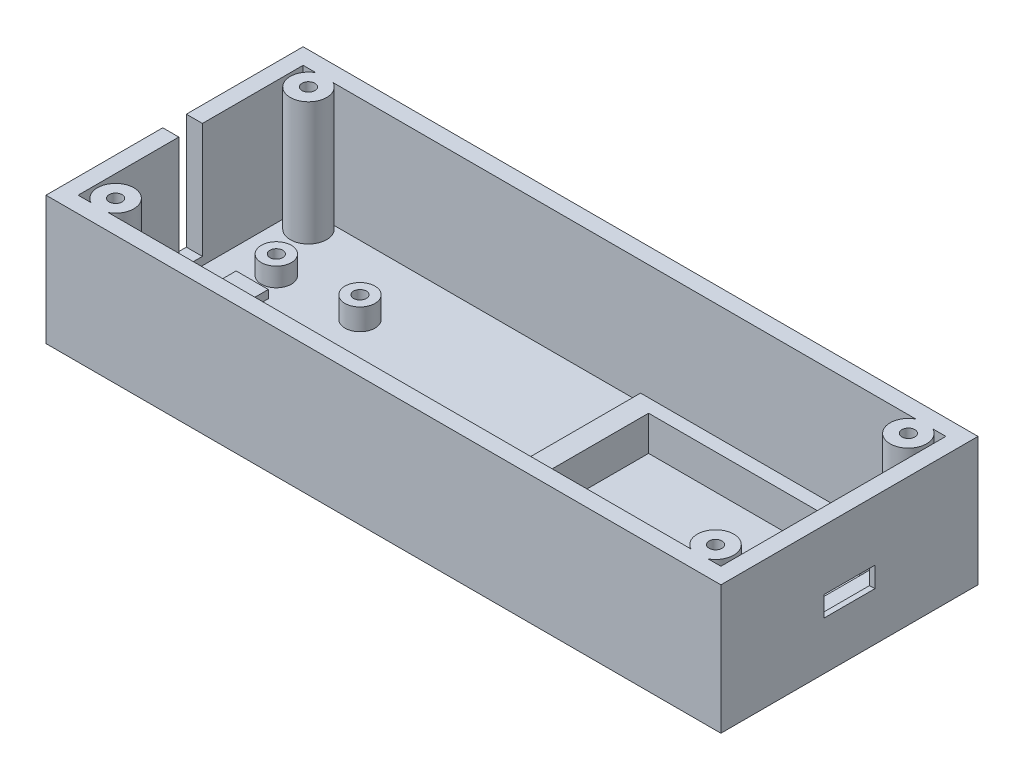
from build123d import *

# Parameters (mm, degrees)
SKETCH1_W           = 126
SKETCH1_H           = 48
BOSS_EXTRUDE1_DEPTH = 25.5
CHAMFER1_SIZE       = 1.5
SKETCH2_W           = 120
SKETCH2_H           = 42
CUT_EXTRUDE1_DEPTH  = 23
SKETCH3_R           = 3.4
BOSS_EXTRUDE2_DEPTH = 25.5
SKETCH4_R           = 1.2
CUT_EXTRUDE2_DEPTH  = 13
SKETCH5_R           = 2.8
BOSS_EXTRUDE3_DEPTH = 6.5
SKETCH6_R           = 1.2
CUT_EXTRUDE3_DEPTH  = 5
SKETCH7_R           = 2.8
BOSS_EXTRUDE4_DEPTH = 6
SKETCH8_W           = 6
SKETCH8_H           = 6
BOSS_EXTRUDE5_DEPTH = 4
SKETCH9_R           = 1.2
CUT_EXTRUDE4_DEPTH  = 5
SKETCH10_W          = 5
SKETCH10_H          = 4.4
CUT_EXTRUDE5_DEPTH  = 21.5
SKETCH11_W          = 52
SKETCH11_H          = 32
SKETCH11_W_2        = 46
SKETCH11_H_2        = 27
BOSS_EXTRUDE6_DEPTH = 9
SKETCH12_W          = 28.4
SKETCH12_H          = 7
CUT_EXTRUDE7_DEPTH  = 2
SKETCH13_W          = 9.5
SKETCH13_H          = 3.8
CUT_EXTRUDE8_DEPTH  = 2


with BuildPart() as part:
    # Sketch1 → Boss-Extrude1 (new body)
    with BuildSketch(Plane(origin=(0, 0, 0), x_dir=(1, 0, 0), z_dir=(0, 1, 0))):
        Rectangle(SKETCH1_W, SKETCH1_H)
    extrude(amount=BOSS_EXTRUDE1_DEPTH)

    # Chamfer1
    chamfer1_edges = [part.edges().sort_by_distance(p)[0] for p in [
        (0, 0, -24),
        (63, 0, 0),
        (0, 0, 24),
        (-63, 0, 0),
    ]]
    chamfer(chamfer1_edges, length=CHAMFER1_SIZE)

    # Sketch2 → Cut-Extrude1 (cut)
    with BuildSketch(Plane(origin=(0, 25.5, 0), x_dir=(1, 0, 0), z_dir=(0, 1, 0))):
        Rectangle(SKETCH2_W, SKETCH2_H)
    extrude(amount=-CUT_EXTRUDE1_DEPTH, mode=Mode.SUBTRACT)

    # Sketch3 → Boss-Extrude2 (add)
    with BuildSketch(Plane(origin=(0, 0, 0), x_dir=(1, 0, 0), z_dir=(0, 1, 0))):
        with Locations((-56, 18)):
            Circle(SKETCH3_R)
        with Locations((-56, -18)):
            Circle(SKETCH3_R)
        with Locations((56, 18)):
            Circle(SKETCH3_R)
        with Locations((56, -18)):
            Circle(SKETCH3_R)
    extrude(amount=BOSS_EXTRUDE2_DEPTH)

    # Sketch4 → Cut-Extrude2 (cut)
    with BuildSketch(Plane(origin=(0, 25.5, 0), x_dir=(1, 0, 0), z_dir=(0, 1, 0))):
        with Locations(Location((-56, 18, 0), (0, 0, 270))):
            Circle(SKETCH4_R)
        with Locations(Location((-56, -18, 0), (0, 0, 270))):
            Circle(SKETCH4_R)
        with Locations(Location((56, 18, 0), (0, 0, 270))):
            Circle(SKETCH4_R)
        with Locations(Location((56, -18, 0), (0, 0, 270))):
            Circle(SKETCH4_R)
    extrude(amount=-CUT_EXTRUDE2_DEPTH, mode=Mode.SUBTRACT)

    # Sketch5 → Boss-Extrude3 (add)
    with BuildSketch(Plane(origin=(0, 0, 0), x_dir=(1, 0, 0), z_dir=(0, 1, 0))):
        with Locations(Location((-36.59, 8.21, 0), (0, 0, 90))):
            Circle(SKETCH5_R)
        with Locations(Location((-7.59, -8.21, 0), (0, 0, 90))):
            Circle(SKETCH5_R)
    extrude(amount=BOSS_EXTRUDE3_DEPTH)

    # Sketch6 → Cut-Extrude3 (cut)
    with BuildSketch(Plane(origin=(0, 6.5, 0), x_dir=(1, 0, 0), z_dir=(0, 1, 0))):
        with Locations(Location((-36.59, 8.21, 0), (0, 0, 270))):
            Circle(SKETCH6_R)
        with Locations(Location((-7.59, -8.21, 0), (0, 0, 270))):
            Circle(SKETCH6_R)
    extrude(amount=-CUT_EXTRUDE3_DEPTH, mode=Mode.SUBTRACT)

    # Sketch7 → Boss-Extrude4 (add)
    with BuildSketch(Plane(origin=(0, 0, 0), x_dir=(1, 0, 0), z_dir=(0, 1, 0))):
        with Locations(Location((-51.5, 7.5, 0), (0, 0, 90))):
            Circle(SKETCH7_R)
        with Locations(Location((-51.5, -7.5, 0), (0, 0, 90))):
            Circle(SKETCH7_R)
    extrude(amount=BOSS_EXTRUDE4_DEPTH)

    # Sketch8 → Boss-Extrude5 (add)
    with BuildSketch(Plane(origin=(0, 0, 0), x_dir=(1, 0, 0), z_dir=(0, 1, 0))):
        with Locations((-51.5, 0)):
            Rectangle(SKETCH8_W, SKETCH8_H)
    extrude(amount=BOSS_EXTRUDE5_DEPTH)

    # Sketch9 → Cut-Extrude4 (cut)
    with BuildSketch(Plane(origin=(0, 6, 0), x_dir=(1, 0, 0), z_dir=(0, 1, 0))):
        with Locations(Location((-51.5, 7.5, 0), (0, 0, 270))):
            Circle(SKETCH9_R)
        with Locations(Location((-51.5, -7.5, 0), (0, 0, 270))):
            Circle(SKETCH9_R)
    extrude(amount=-CUT_EXTRUDE4_DEPTH, mode=Mode.SUBTRACT)

    # Sketch10 → Cut-Extrude5 (cut)
    with BuildSketch(Plane(origin=(0, 25.5, 0), x_dir=(1, 0, 0), z_dir=(0, 1, 0))):
        with Locations((-61.5, 0)):
            Rectangle(SKETCH10_W, SKETCH10_H)
    extrude(amount=-CUT_EXTRUDE5_DEPTH, mode=Mode.SUBTRACT)

    # Sketch11 → Boss-Extrude6 (add)
    with BuildSketch(Plane(origin=(0, 0, 0), x_dir=(1, 0, 0), z_dir=(0, 1, 0))):
        with Locations((34, 0)):
            Rectangle(SKETCH11_W, SKETCH11_H)
        with Locations((35, 0)):
            Rectangle(SKETCH11_W_2, SKETCH11_H_2, mode=Mode.SUBTRACT)
    extrude(amount=BOSS_EXTRUDE6_DEPTH)

    # Sketch12 → Cut-Extrude7 (cut)
    with BuildSketch(Plane(origin=(60, 0, 0), x_dir=(0, 0, -1), z_dir=(1, 0, 0))):
        with Locations((0, 12.5)):
            Rectangle(SKETCH12_W, SKETCH12_H)
    extrude(amount=CUT_EXTRUDE7_DEPTH, mode=Mode.SUBTRACT)

    # Sketch13 → Cut-Extrude8 (cut)
    with BuildSketch(Plane(origin=(63, 0, 0), x_dir=(0, 0, -1), z_dir=(1, 0, 0))):
        with Locations((0, 12.4)):
            Rectangle(SKETCH13_W, SKETCH13_H)
    extrude(amount=-CUT_EXTRUDE8_DEPTH, mode=Mode.SUBTRACT)


solid = part.part
